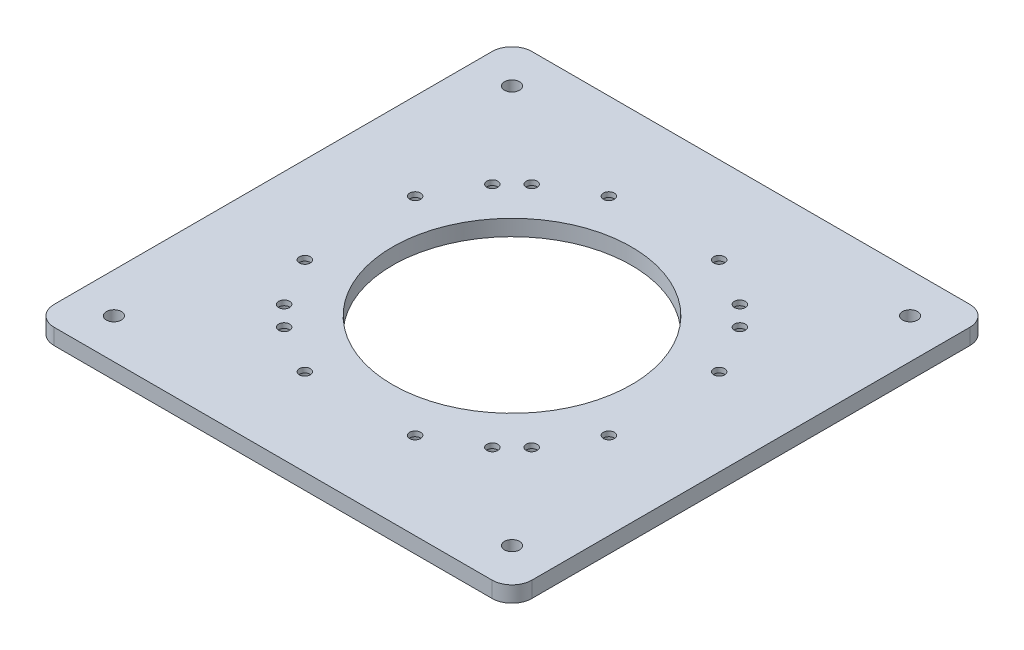
from build123d import *

# Parameters (mm, degrees)
SKETCH_1_W          = 240
SKETCH_1_H          = 240
SKETCH_1_R          = 60
EXTRUDE_1_DEPTH     = 8
SKETCH_2_R          = 2.75
SKETCH_2_R_2        = 3.75
CUT_EXTRUDE_1_DEPTH = 10
FILLET_1_R          = 10
SKETCH_3_R          = 6
CUT_EXTRUDE_2_DEPTH = 5.5


with BuildPart() as part:
    # 草图1 → 凸台-拉伸1 (new body)
    with BuildSketch(Plane(origin=(0, 0, 0), x_dir=(1, 0, 0), z_dir=(0, 1, 0))):
        with Locations((120, -120)):
            Rectangle(SKETCH_1_W, SKETCH_1_H)
        with Locations(Location((120, -120, 0), (0, 0, 270))):
            Circle(SKETCH_1_R, mode=Mode.SUBTRACT)
    extrude(amount=EXTRUDE_1_DEPTH)

    # 草图2 → 切除-拉伸1 (cut)
    with BuildSketch(Plane(origin=(0, 8, 0), x_dir=(1, 0, 0), z_dir=(0, 1, 0))):
        with Locations(Location((92.293791985, -43.619841991, 0), (0, 0, 270))):
            Circle(SKETCH_2_R)
        with Locations(Location((147.706208015, -43.619841991, 0), (0, 0, 270))):
            Circle(SKETCH_2_R)
        with Locations(Location((172.294053173, -57.815641012, 0), (0, 0, 270))):
            Circle(SKETCH_2_R)
        with Locations(Location((182.184358988, -67.705946827, 0), (0, 0, 270))):
            Circle(SKETCH_2_R)
        with Locations(Location((196.380158009, -92.293791985, 0), (0, 0, 270))):
            Circle(SKETCH_2_R)
        with Locations(Location((196.380158009, -147.706208015, 0), (0, 0, 270))):
            Circle(SKETCH_2_R)
        with Locations(Location((182.184358988, -172.294053173, 0), (0, 0, 270))):
            Circle(SKETCH_2_R)
        with Locations(Location((172.294053173, -182.184358988, 0), (0, 0, 270))):
            Circle(SKETCH_2_R)
        with Locations(Location((147.706208015, -196.380158009, 0), (0, 0, 270))):
            Circle(SKETCH_2_R)
        with Locations(Location((92.293791985, -196.380158009, 0), (0, 0, 270))):
            Circle(SKETCH_2_R)
        with Locations(Location((67.705946827, -182.184358988, 0), (0, 0, 270))):
            Circle(SKETCH_2_R)
        with Locations(Location((57.815641012, -172.294053173, 0), (0, 0, 270))):
            Circle(SKETCH_2_R)
        with Locations(Location((43.619841991, -147.706208015, 0), (0, 0, 270))):
            Circle(SKETCH_2_R)
        with Locations(Location((43.619841991, -92.293791985, 0), (0, 0, 270))):
            Circle(SKETCH_2_R)
        with Locations(Location((57.815641012, -67.705946827, 0), (0, 0, 270))):
            Circle(SKETCH_2_R)
        with Locations(Location((67.705946827, -57.815641012, 0), (0, 0, 270))):
            Circle(SKETCH_2_R)
        with Locations(Location((220, -20, 0), (0, 0, 270))):
            Circle(SKETCH_2_R_2)
        with Locations(Location((20, -20, 0), (0, 0, 270))):
            Circle(SKETCH_2_R_2)
        with Locations(Location((20, -220, 0), (0, 0, 270))):
            Circle(SKETCH_2_R_2)
        with Locations(Location((220, -220, 0), (0, 0, 270))):
            Circle(SKETCH_2_R_2)
    extrude(amount=-CUT_EXTRUDE_1_DEPTH, mode=Mode.SUBTRACT)

    # 圆角1
    fillet_1_edges = [part.edges().sort_by_distance(p)[0] for p in [
        (0, 4, 0),
        (240, 4, 0),
        (240, 4, 240),
        (0, 4, 240),
    ]]
    fillet(fillet_1_edges, radius=FILLET_1_R)

    # 草图3 → 切除-拉伸2 (cut)
    with BuildSketch(Plane.XZ):
        with Locations(Location((147.706208015, 196.380158009, 0), (0, 0, 270))):
            Circle(SKETCH_3_R)
        with Locations(Location((172.294053173, 182.184358988, 0), (0, 0, 270))):
            Circle(SKETCH_3_R)
        with Locations(Location((182.184358988, 172.294053173, 0), (0, 0, 270))):
            Circle(SKETCH_3_R)
        with Locations(Location((196.380158009, 147.706208015, 0), (0, 0, 270))):
            Circle(SKETCH_3_R)
        with Locations(Location((196.380158009, 92.293791985, 0), (0, 0, 270))):
            Circle(SKETCH_3_R)
        with Locations(Location((182.184358988, 67.705946827, 0), (0, 0, 270))):
            Circle(SKETCH_3_R)
        with Locations(Location((172.294053173, 57.815641012, 0), (0, 0, 270))):
            Circle(SKETCH_3_R)
        with Locations(Location((147.706208015, 43.619841991, 0), (0, 0, 270))):
            Circle(SKETCH_3_R)
        with Locations(Location((92.293791985, 43.619841991, 0), (0, 0, 270))):
            Circle(SKETCH_3_R)
        with Locations(Location((67.705946827, 57.815641012, 0), (0, 0, 270))):
            Circle(SKETCH_3_R)
        with Locations(Location((57.815641012, 67.705946827, 0), (0, 0, 270))):
            Circle(SKETCH_3_R)
        with Locations(Location((43.619841991, 92.293791985, 0), (0, 0, 270))):
            Circle(SKETCH_3_R)
        with Locations(Location((43.619841991, 147.706208015, 0), (0, 0, 270))):
            Circle(SKETCH_3_R)
        with Locations(Location((57.815641012, 172.294053173, 0), (0, 0, 270))):
            Circle(SKETCH_3_R)
        with Locations(Location((67.705946827, 182.184358988, 0), (0, 0, 270))):
            Circle(SKETCH_3_R)
        with Locations(Location((92.293791985, 196.380158009, 0), (0, 0, 270))):
            Circle(SKETCH_3_R)
    extrude(amount=-CUT_EXTRUDE_2_DEPTH, mode=Mode.SUBTRACT)


solid = part.part
